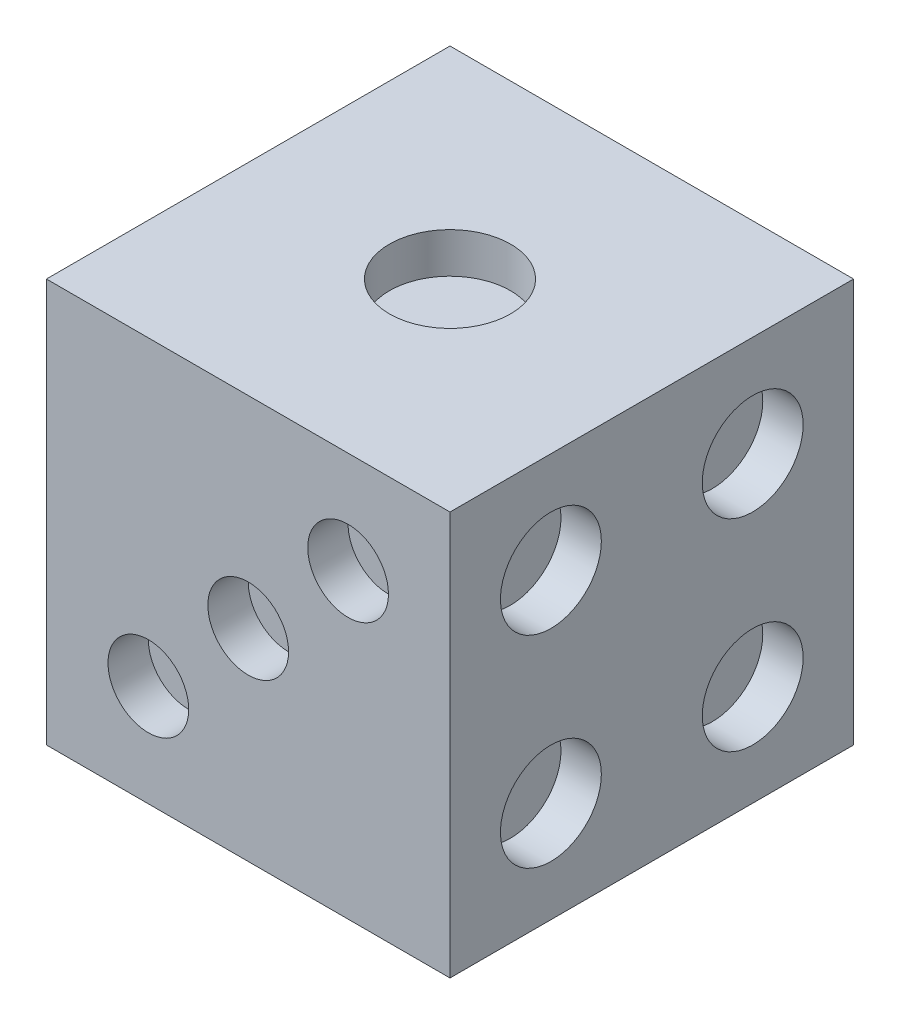
from build123d import *

# Parameters (mm, degrees)
SKETCH1_W           = 100
SKETCH1_H           = 100
BOSS_EXTRUDE1_DEPTH = 100
SKETCH3_R           = 15
CUT_EXTRUDE1_DEPTH  = 10
SKETCH5_R           = 10
CUT_EXTRUDE2_DEPTH  = 10
SKETCH8_R           = 13
CUT_EXTRUDE3_DEPTH  = 10
SKETCH12_R          = 12.5
CUT_EXTRUDE4_DEPTH  = 10
CUT_EXTRUDE5_START  = -10
SKETCH13_R          = 10
CUT_EXTRUDE5_DEPTH  = 10
SKETCH14_R          = 10
CUT_EXTRUDE6_DEPTH  = 10


with BuildPart() as part:
    # Sketch1 → Boss-Extrude1 (new body)
    with BuildSketch(Plane(origin=(0, 0, 0), x_dir=(1, 0, 0), z_dir=(0, 1, 0))):
        Rectangle(SKETCH1_W, SKETCH1_H)
    extrude(amount=BOSS_EXTRUDE1_DEPTH)

    # Sketch3 → Cut-Extrude1 (cut)
    with BuildSketch(Plane(origin=(0, 100, 0), x_dir=(1, 0, 0), z_dir=(0, 1, 0))):
        with Locations(Location((0, 0, 0), (0, 0, 270))):
            Circle(SKETCH3_R)
    extrude(amount=-CUT_EXTRUDE1_DEPTH, mode=Mode.SUBTRACT)

    # Sketch5 → Cut-Extrude2 (cut)
    with BuildSketch(Plane.XY.offset(50)):
        with Locations((0, 50)):
            Circle(SKETCH5_R)
        with Locations((24.748737342, 74.748737342)):
            Circle(SKETCH5_R)
        with Locations((-24.748737342, 25.251262658)):
            Circle(SKETCH5_R)
    extrude(amount=-CUT_EXTRUDE2_DEPTH, mode=Mode.SUBTRACT)

    # Sketch8 → Cut-Extrude3 (cut)
    with BuildSketch(Plane.ZY.offset(50)):
        with Locations((-16.970562748, 66.970562748)):
            Circle(SKETCH8_R)
        with Locations((16.970562748, 33.029437252)):
            Circle(SKETCH8_R)
    extrude(amount=-CUT_EXTRUDE3_DEPTH, mode=Mode.SUBTRACT)

    # Sketch12 → Cut-Extrude4 (cut)
    with BuildSketch(Plane(origin=(50, 0, 0), x_dir=(0, 0, -1), z_dir=(1, 0, 0))):
        with Locations((-25, 75)):
            Circle(SKETCH12_R)
        with Locations((25, 75)):
            Circle(SKETCH12_R)
        with Locations((25, 25)):
            Circle(SKETCH12_R)
        with Locations((-25, 25)):
            Circle(SKETCH12_R)
    extrude(amount=-CUT_EXTRUDE4_DEPTH, mode=Mode.SUBTRACT)

    # Sketch13 → Cut-Extrude5 (cut)
    with BuildSketch(Plane(origin=(0, 0, -50), x_dir=(-1, 0, 0), z_dir=(0, 0, -1)).offset(CUT_EXTRUDE5_START)):
        with Locations(Location((0, 50, 0), (0, 0, 180))):
            Circle(SKETCH13_R)
        with Locations((-27.5, 77.5)):
            Circle(SKETCH13_R)
        with Locations((27.5, 77.5)):
            Circle(SKETCH13_R)
        with Locations((27.5, 22.5)):
            Circle(SKETCH13_R)
        with Locations((-27.5, 22.5)):
            Circle(SKETCH13_R)
    extrude(amount=CUT_EXTRUDE5_DEPTH, mode=Mode.SUBTRACT)

    # Sketch14 → Cut-Extrude6 (cut)
    with BuildSketch(Plane(origin=(0, 0, 0), x_dir=(-1, 0, 0), z_dir=(0, -1, 0))):
        with Locations(Location((-16.67, 0, 0), (0, 0, 90))):
            Circle(SKETCH14_R)
        with Locations(Location((16.67, 0, 0), (0, 0, 90))):
            Circle(SKETCH14_R)
        with Locations(Location((16.67, 25, 0), (0, 0, 90))):
            Circle(SKETCH14_R)
        with Locations(Location((-16.67, 25, 0), (0, 0, 90))):
            Circle(SKETCH14_R)
        with Locations(Location((-16.67, -25, 0), (0, 0, 90))):
            Circle(SKETCH14_R)
        with Locations(Location((16.67, -25, 0), (0, 0, 90))):
            Circle(SKETCH14_R)
    extrude(amount=-CUT_EXTRUDE6_DEPTH, mode=Mode.SUBTRACT)


solid = part.part
